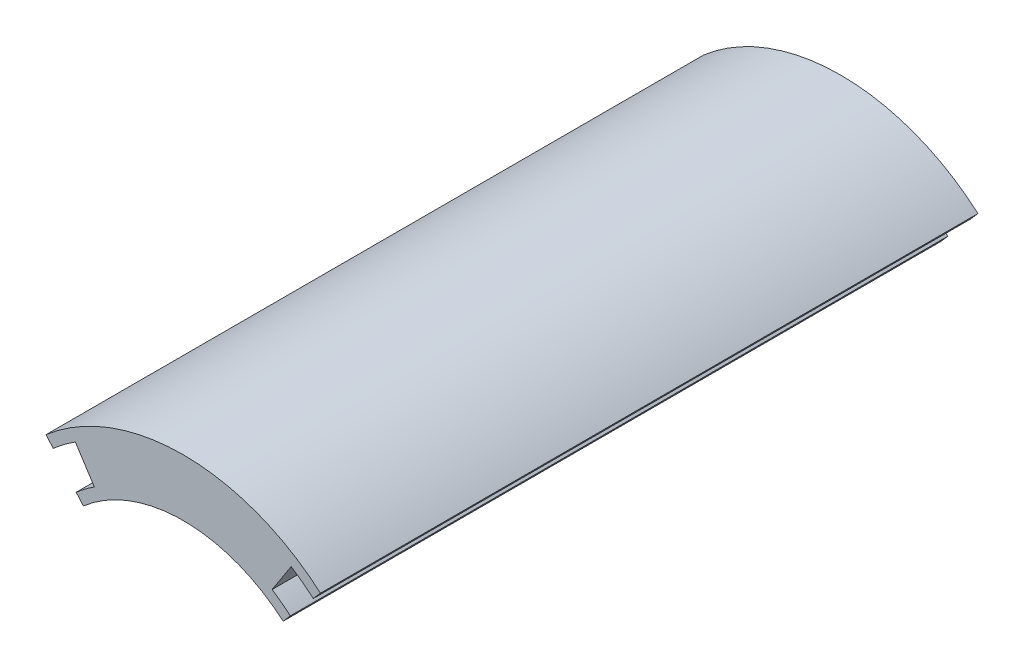
from build123d import *

# Parameters (mm, degrees)
BOSS_EXTRUDE1_DEPTH = 60


with BuildPart() as part:
    # Sketch1 → Boss-Extrude1 (new body)
    with BuildSketch(Plane.XY):
        with BuildLine():
            Line((-12.523161953, 14.421526088), (-11.867499023, 13.666472366))
            ThreePointArc((-11.867499023, 13.666472366), (-10.885265471, 14.46101641), (-9.85, 15.185107836))
            Line((-9.85, 15.185107836), (-8.108563536, 12.500447887))
            ThreePointArc((-8.108563536, 12.500447887), (-8.960798648, 11.904372625), (-9.769377649, 11.250300456))
            Line((-9.769377649, 11.250300456), (-9.113714719, 10.495246734))
            ThreePointArc((-9.113714719, 10.495246734), (0, 13.9), (9.113714719, 10.495246734))
            Line((9.113714719, 10.495246734), (9.769377649, 11.250300456))
            ThreePointArc((9.769377649, 11.250300456), (8.960798648, 11.904372625), (8.108563536, 12.500447887))
            Line((8.108563536, 12.500447887), (9.85, 15.185107836))
            ThreePointArc((9.85, 15.185107836), (10.885265471, 14.46101641), (11.867499023, 13.666472366))
            Line((11.867499023, 13.666472366), (12.523161953, 14.421526088))
            ThreePointArc((12.523161953, 14.421526088), (0, 19.1), (-12.523161953, 14.421526088))
        make_face()
    extrude(amount=BOSS_EXTRUDE1_DEPTH)


solid = part.part
